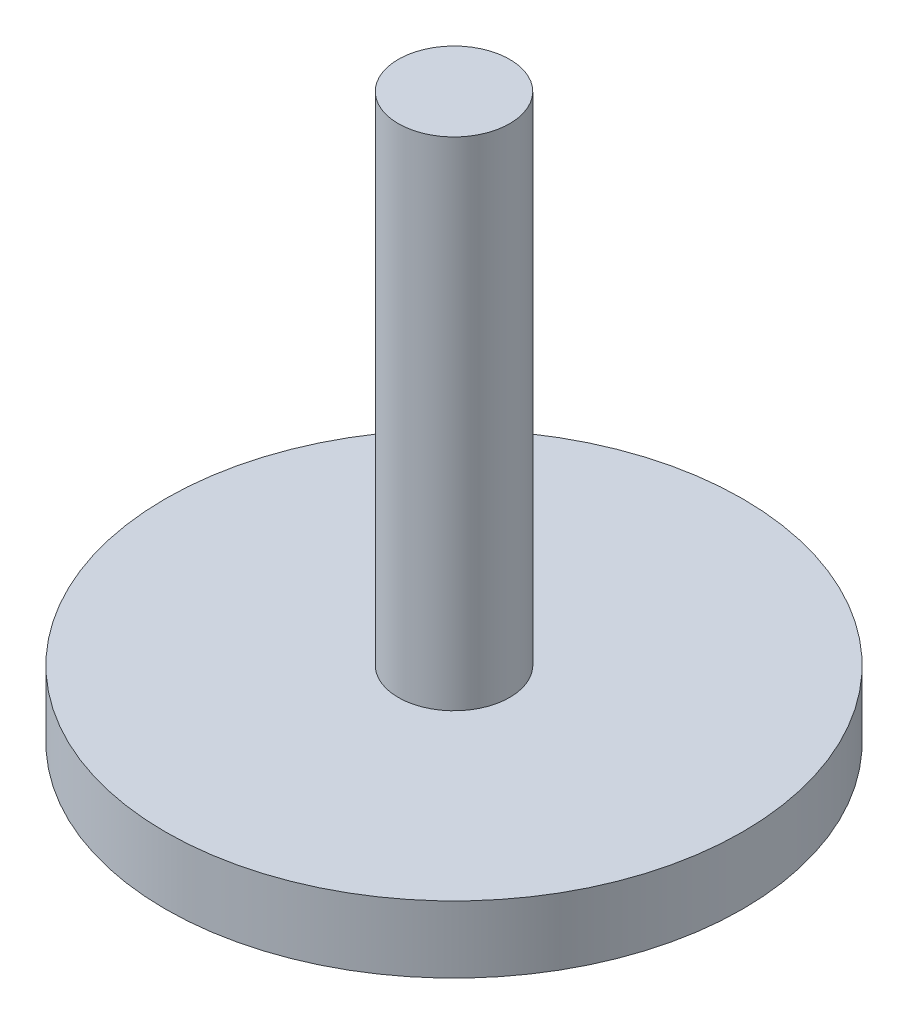
from build123d import *

# Parameters (mm, degrees)
SKETCH1_R           = 2.5
BOSS_EXTRUDE1_DEPTH = 3
SKETCH2_R           = 12.95
BOSS_EXTRUDE2_DEPTH = 3
SKETCH3_R           = 2.5
BOSS_EXTRUDE3_DEPTH = 22.3


with BuildPart() as part:
    # Sketch1 → Boss-Extrude1 (new body)
    with BuildSketch(Plane(origin=(0, 0, 0), x_dir=(1, 0, 0), z_dir=(0, 1, 0))):
        with Locations(Location((0, 0, 0), (0, 0, 270))):
            Circle(SKETCH1_R)
    extrude(amount=BOSS_EXTRUDE1_DEPTH)

    # Sketch2 → Boss-Extrude2 (add)
    with BuildSketch(Plane(origin=(0, 3, 0), x_dir=(1, 0, 0), z_dir=(0, 1, 0))):
        with Locations(Location((0, 0, 0), (0, 0, 270))):
            Circle(SKETCH2_R)
    extrude(amount=BOSS_EXTRUDE2_DEPTH)

    # Sketch3 → Boss-Extrude3 (add)
    with BuildSketch(Plane(origin=(0, 6, 0), x_dir=(1, 0, 0), z_dir=(0, 1, 0))):
        with Locations(Location((0, 0, 0), (0, 0, 270))):
            Circle(SKETCH3_R)
    extrude(amount=BOSS_EXTRUDE3_DEPTH)


solid = part.part
